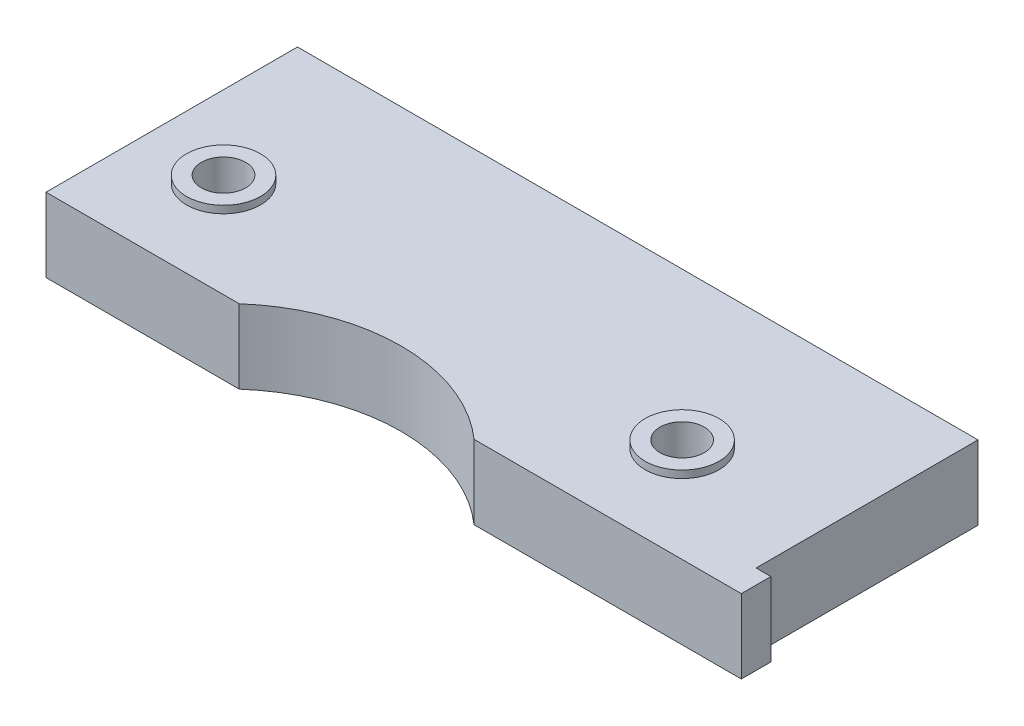
from build123d import *

# Parameters (mm, degrees)
SKETCH1_R           = 1.5
BOSS_EXTRUDE1_DEPTH = 5
SKETCH2_R           = 2.5
SKETCH2_R_2         = 1.5
BOSS_EXTRUDE2_DEPTH = 0.5


with BuildPart() as part:
    # Sketch1 → Boss-Extrude1 (new body)
    with BuildSketch(Plane(origin=(0, 0, 0), x_dir=(1, 0, 0), z_dir=(0, 1, 0))):
        with BuildLine():
            Line((40.5, -6.5), (41.5, -6.5))
            Line((41.5, -6.5), (41.5, -4.5))
            Line((41.5, -4.5), (40.5, -4.5))
            Line((40.5, -4.5), (40.5, 10.5))
            Line((40.5, 10.5), (-5.5, 10.5))
            Line((-5.5, 10.5), (-5.5, -6.5))
            Line((-5.5, -6.5), (7.562746067, -6.5))
            ThreePointArc((7.562746067, -6.5), (15.5, -3.5), (23.437253933, -6.5))
            Line((23.437253933, -6.5), (40.5, -6.5))
        make_face()
        with Locations(Location((0, 0, 0), (0, 0, 270))):
            Circle(SKETCH1_R, mode=Mode.SUBTRACT)
        with Locations(Location((31, 0, 0), (0, 0, 270))):
            Circle(SKETCH1_R, mode=Mode.SUBTRACT)
    extrude(amount=BOSS_EXTRUDE1_DEPTH)

    # Sketch2 → Boss-Extrude2 (add)
    # profile 1 of 2: a face of its own
    with BuildSketch(Plane(origin=(0, 5, 0), x_dir=(1, 0, 0), z_dir=(0, 1, 0))):
        with Locations(Location((0, 0, 0), (0, 0, 270))):
            Circle(SKETCH2_R)
        with Locations(Location((0, 0, 0), (0, 0, 270))):
            Circle(SKETCH2_R_2, mode=Mode.SUBTRACT)
    # profile 2 of 2: a face of its own
    with BuildSketch(Plane(origin=(0, 5, 0), x_dir=(1, 0, 0), z_dir=(0, 1, 0))):
        with Locations(Location((31, 0, 0), (0, 0, 270))):
            Circle(SKETCH2_R)
        with Locations(Location((31, 0, 0), (0, 0, 270))):
            Circle(SKETCH2_R_2, mode=Mode.SUBTRACT)
    extrude(amount=BOSS_EXTRUDE2_DEPTH)


solid = part.part
